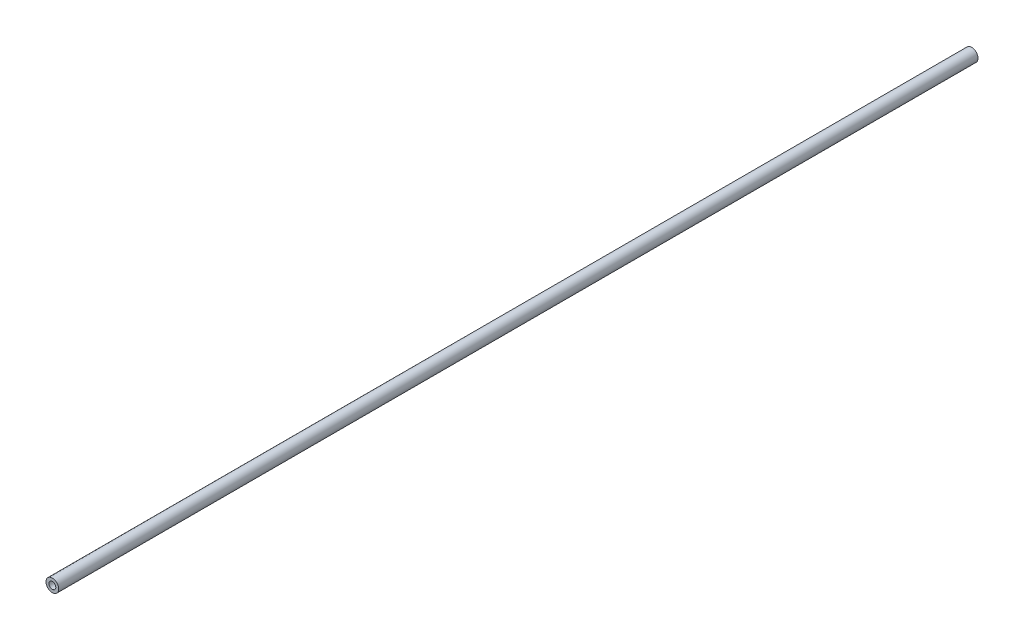
from build123d import *

# Parameters (mm, degrees)
SKETCH1_R      = 2.2225
SKETCH1_R_2    = 1.2065
EXTRUDE1_DEPTH = 322.072


with BuildPart() as part:
    # Sketch1 → Extrude1 (new body)
    with BuildSketch(Plane.XY):
        Circle(SKETCH1_R)
        Circle(SKETCH1_R_2, mode=Mode.SUBTRACT)
    extrude(amount=EXTRUDE1_DEPTH)


solid = part.part
